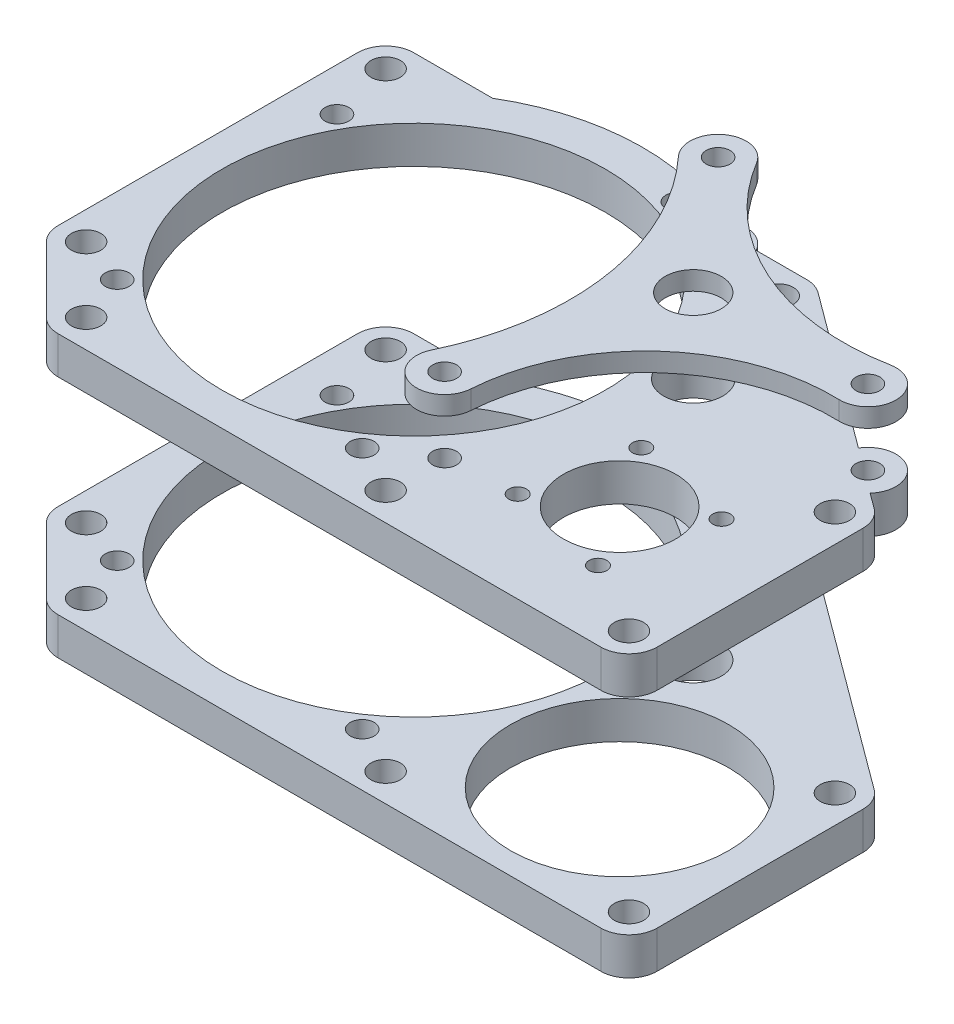
from build123d import *

# Parameters (mm, degrees)
SKETCH3_R               = 32.5
SKETCH3_R_2             = 2.4892
SKETCH3_R_3             = 18.5166
SKETCH3_R_4             = 4.7625
BOSS_EXTRUDE1_DEPTH     = 6.35
SKETCH4_R               = 2.4892
SKETCH4_R_2             = 5.0165
SKETCH4_R_3             = 9.525
SKETCH4_R_4             = 32.5
SKETCH4_R_5             = 2.0193
BOSS_EXTRUDE2_DEPTH     = 6.35
SKETCH6_R               = 4.7625
SKETCH6_R_2             = 2.0193
BOSS_EXTRUDE3_DEPTH     = 3.175
SKETCH8_R               = 1.5
CUT_EXTRUDE1_DEPTH      = 97.666893408
CUT_EXTRUDE2_DEPTH      = 97.666893408
CUT_EXTRUDE2_DEPTH_BACK = 97.666893408
SKETCH9_R               = 2.0193
BOSS_EXTRUDE4_DEPTH     = 6.35
BOSS_EXTRUDE5_DEPTH     = 6.35


with BuildPart() as part:
    # Sketch3 → Boss-Extrude1 (new body)
    with BuildSketch(Plane(origin=(0, 31.1, 0), x_dir=(1, 0, 0), z_dir=(0, 1, 0))):
        with BuildLine():
            Line((-38.1, 28.575), (-38.1, -22.225))
            ThreePointArc((-38.1, -22.225), (-37.737476274, -24.047529847), (-36.705096045, -25.592596045))
            Line((-36.705096045, -25.592596045), (-25.592596045, -36.705096045))
            ThreePointArc((-25.592596045, -36.705096045), (-24.047529847, -37.737476274), (-22.225, -38.1))
            Line((-22.225, -38.1), (69.85, -38.1))
            ThreePointArc((69.85, -38.1), (73.217596045, -36.705096045), (74.6125, -33.3375))
            Line((74.6125, -33.3375), (74.6125, 1.5875))
            ThreePointArc((74.6125, 1.5875), (74.102236551, 3.732235546), (72.680787428, 5.417388874))
            Line((72.680787428, 5.417388874), (36.168287428, 32.404888874))
            ThreePointArc((36.168287428, 32.404888874), (34.827728252, 33.098342349), (33.3375, 33.3375))
            Line((33.3375, 33.3375), (19.948272952, 33.3375))
            ThreePointArc((19.948272952, 33.3375), (0, 38.85), (-19.948272952, 33.3375))
            Line((-19.948272952, 33.3375), (-33.3375, 33.3375))
            ThreePointArc((-33.3375, 33.3375), (-36.705096045, 31.942596045), (-38.1, 28.575))
        make_face()
        with Locations(Location((0, 0, 0), (0, 0, 270))):
            Circle(SKETCH3_R, mode=Mode.SUBTRACT)
        with Locations(Location((-33.3375, 28.575, 0), (0, 0, 270))):
            Circle(SKETCH3_R_2, mode=Mode.SUBTRACT)
        with Locations(Location((-33.3375, -22.225, 0), (0, 0, 270))):
            Circle(SKETCH3_R_2, mode=Mode.SUBTRACT)
        with Locations(Location((-22.225, -33.3375, 0), (0, 0, 270))):
            Circle(SKETCH3_R_2, mode=Mode.SUBTRACT)
        with Locations(Location((28.575, -33.3375, 0), (0, 0, 270))):
            Circle(SKETCH3_R_2, mode=Mode.SUBTRACT)
        with Locations(Location((50.8, -15.875, 0), (0, 0, 270))):
            Circle(SKETCH3_R_3, mode=Mode.SUBTRACT)
        with Locations(Location((38.300729341, 9.113233891, 0), (0, 0, 270))):
            Circle(SKETCH3_R_4, mode=Mode.SUBTRACT)
        with Locations(Location((69.85, -33.3375, 0), (0, 0, 270))):
            Circle(SKETCH3_R_2, mode=Mode.SUBTRACT)
        with Locations(Location((69.85, 1.5875, 0), (0, 0, 270))):
            Circle(SKETCH3_R_2, mode=Mode.SUBTRACT)
        with Locations(Location((33.3375, 28.575, 0), (0, 0, 270))):
            Circle(SKETCH3_R_2, mode=Mode.SUBTRACT)
    extrude(amount=-BOSS_EXTRUDE1_DEPTH)


with BuildPart() as body_2:
    # Sketch4 → Boss-Extrude2 (new body)
    with BuildSketch(Plane(origin=(0, 66.025, 0), x_dir=(1, 0, 0), z_dir=(0, 1, 0))):
        with BuildLine():
            Line((62.449667408, 12.979521063), (36.168287428, 32.404888874))
            ThreePointArc((36.168287428, 32.404888874), (34.827728252, 33.098342349), (33.3375, 33.3375))
            Line((33.3375, 33.3375), (24.73840367, 33.3375))
            ThreePointArc((24.73840367, 33.3375), (21.42154073, 35.770829295), (17.446327433, 34.712363202))
            ThreePointArc((17.446327433, 34.712363202), (-1.427408509, 38.823768557), (-19.948272952, 33.3375))
            Line((-19.948272952, 33.3375), (-33.3375, 33.3375))
            ThreePointArc((-33.3375, 33.3375), (-36.705096045, 31.942596045), (-38.1, 28.575))
            Line((-38.1, 28.575), (-38.1, -22.225))
            ThreePointArc((-38.1, -22.225), (-37.737476274, -24.047529847), (-36.705096045, -25.592596045))
            Line((-36.705096045, -25.592596045), (-25.592596045, -36.705096045))
            ThreePointArc((-25.592596045, -36.705096045), (-24.047529847, -37.737476274), (-22.225, -38.1))
            Line((-22.225, -38.1), (69.85, -38.1))
            ThreePointArc((69.85, -38.1), (73.217596045, -36.705096045), (74.6125, -33.3375))
            Line((74.6125, -33.3375), (74.6125, 1.5875))
            ThreePointArc((74.6125, 1.5875), (74.102236551, 3.732235546), (72.680787428, 5.417388874))
            Line((72.680787428, 5.417388874), (70.077016055, 7.341915541))
            ThreePointArc((70.077016055, 7.341915541), (69.354337654, 14.342653962), (62.449667408, 12.979521063))
        make_face()
        with Locations(Location((33.3375, 28.575, 0), (0, 0, 270))):
            Circle(SKETCH4_R, mode=Mode.SUBTRACT)
        with Locations(Location((69.85, 1.5875, 0), (0, 0, 270))):
            Circle(SKETCH4_R, mode=Mode.SUBTRACT)
        with Locations(Location((69.85, -33.3375, 0), (0, 0, 270))):
            Circle(SKETCH4_R, mode=Mode.SUBTRACT)
        with Locations(Location((28.575, -33.3375, 0), (0, 0, 270))):
            Circle(SKETCH4_R, mode=Mode.SUBTRACT)
        with Locations(Location((-22.225, -33.3375, 0), (0, 0, 270))):
            Circle(SKETCH4_R, mode=Mode.SUBTRACT)
        with Locations(Location((-33.3375, -22.225, 0), (0, 0, 270))):
            Circle(SKETCH4_R, mode=Mode.SUBTRACT)
        with Locations(Location((-33.3375, 28.575, 0), (0, 0, 270))):
            Circle(SKETCH4_R, mode=Mode.SUBTRACT)
        with Locations(Location((38.300729341, 9.113233891, 0), (0, 0, 270))):
            Circle(SKETCH4_R_2, mode=Mode.SUBTRACT)
        with Locations(Location((50.8, -15.875, 0), (0, 0, 270))):
            Circle(SKETCH4_R_3, mode=Mode.SUBTRACT)
        with Locations(Location((0, 0, 0), (0, 0, 270))):
            Circle(SKETCH4_R_4, mode=Mode.SUBTRACT)
        with Locations(Location((20.539155692, 31.090786251, 0), (0, 0, 270))):
            Circle(SKETCH4_R_5, mode=Mode.SUBTRACT)
        with Locations(Location((66.523550225, 10.512765088, 0), (0, 0, 270))):
            Circle(SKETCH4_R_5, mode=Mode.SUBTRACT)
        with Locations(Location((28.838908317, -23.596848801, 0), (0, 0, 270))):
            Circle(SKETCH4_R_5, mode=Mode.SUBTRACT)
    extrude(amount=BOSS_EXTRUDE2_DEPTH)

    # Sketch8 → Cut-Extrude1 (cut, through all)
    with BuildSketch(Plane(origin=(0, 72.375, 0), x_dir=(1, 0, 0), z_dir=(0, 1, 0))):
        with Locations(Location((43.992012062, -5.391617901, 0), (0, 0, 270))):
            Circle(SKETCH8_R)
        with Locations(Location((61.283382099, -9.067012062, 0), (0, 0, 270))):
            Circle(SKETCH8_R)
        with Locations(Location((57.607987938, -26.358382099, 0), (0, 0, 270))):
            Circle(SKETCH8_R)
        with Locations(Location((40.316617901, -22.682987938, 0), (0, 0, 270))):
            Circle(SKETCH8_R)
    extrude(amount=-CUT_EXTRUDE1_DEPTH, mode=Mode.SUBTRACT)


with BuildPart() as body_3:
    # Sketch6 → Boss-Extrude3 (new body)
    with BuildSketch(Plane(origin=(0, 81.9, 0), x_dir=(1, 0, 0), z_dir=(0, 1, 0))):
        with BuildLine():
            ThreePointArc((24.617653876, 33.549903737), (17.675966632, 34.896512813), (17.046080919, 27.853528943))
            ThreePointArc((17.046080919, 27.853528943), (28.390816273, 4.30877568), (24.542631677, -21.54175433))
            ThreePointArc((24.542631677, -21.54175433), (27.634265494, -28.204477466), (33.591267315, -23.907477519))
            ThreePointArc((33.591267315, -23.907477519), (43.967359373, -2.438921321), (66.360521149, 5.753056298))
            ThreePointArc((66.360521149, 5.753056298), (71.272225212, 10.87538351), (65.639703676, 15.19253234))
            ThreePointArc((65.639703676, 15.19253234), (42.251924296, 17.942717846), (24.617653876, 33.549903737))
        make_face()
        with Locations(Location((38.300729341, 9.113233891, 0), (0, 0, 270))):
            Circle(SKETCH6_R, mode=Mode.SUBTRACT)
        with Locations(Location((28.838908317, -23.596848801, 0), (0, 0, 270))):
            Circle(SKETCH6_R_2, mode=Mode.SUBTRACT)
        with Locations(Location((66.523550225, 10.512765088, 0), (0, 0, 270))):
            Circle(SKETCH6_R_2, mode=Mode.SUBTRACT)
        with Locations(Location((20.539155692, 31.090786251, 0), (0, 0, 270))):
            Circle(SKETCH6_R_2, mode=Mode.SUBTRACT)
    extrude(amount=BOSS_EXTRUDE3_DEPTH)


with BuildPart() as cut_extrude2_tool:
    # Sketch9 → Cut-Extrude2 (new, two sides: drawn at the far end of the back side and taken through both)
    with BuildSketch(Plane(origin=(0, 72.375, 0), x_dir=(1, 0, 0), z_dir=(0, 1, 0)).offset(-CUT_EXTRUDE2_DEPTH_BACK)):
        with Locations(Location((-25.145212114, -25.145212114, 0), (0, 0, 270))):
            Circle(SKETCH9_R)
        with Locations(Location((20.39677958, -29.129620101, 0), (0, 0, 270))):
            Circle(SKETCH9_R)
        with Locations(Location((-30.796469576, 17.78035, 0), (0, 0, 270))):
            Circle(SKETCH9_R)
        with Locations(Location((10.988860632, 33.820235459, 0), (0, 0, 270))):
            Circle(SKETCH9_R)
    extrude(amount=CUT_EXTRUDE2_DEPTH + CUT_EXTRUDE2_DEPTH_BACK)


with BuildPart() as part_1:
    add(part.part)

    # Cut-Extrude2: cut by cut_extrude2_tool
    add(cut_extrude2_tool.part, mode=Mode.SUBTRACT)

    # Sketch11 → Boss-Extrude5 (add)
    with BuildSketch(Plane(origin=(0, 31.1, 0), x_dir=(1, 0, 0), z_dir=(0, 1, 0))):
        with BuildLine():
            Line((22.684169634, 33.3375), (19.948272952, 33.3375))
            ThreePointArc((19.948272952, 33.3375), (14.422665998, 36.0736636), (8.533760787, 37.901153371))
            ThreePointArc((8.533760787, 37.901153371), (10.448437112, 38.5519739), (12.460554068, 38.349642118))
            ThreePointArc((12.460554068, 38.349642118), (17.750163187, 36.206244835), (22.684169634, 33.3375))
        make_face()
    extrude(amount=-BOSS_EXTRUDE5_DEPTH)


with BuildPart() as body_2_1:
    add(body_2.part)

    # Cut-Extrude2: cut by cut_extrude2_tool
    add(cut_extrude2_tool.part, mode=Mode.SUBTRACT)

    # Sketch10 → Boss-Extrude4 (add)
    with BuildSketch(Plane(origin=(0, 72.375, 0), x_dir=(1, 0, 0), z_dir=(0, 1, 0))):
        with BuildLine():
            ThreePointArc((8.533760787, 37.901153371), (10.448437112, 38.5519739), (12.460554068, 38.349642118))
            ThreePointArc((12.460554068, 38.349642118), (15.77308116, 37.110246145), (18.964261824, 35.585351364))
            ThreePointArc((18.964261824, 35.585351364), (18.164827461, 35.219220786), (17.446327433, 34.712363202))
            ThreePointArc((17.446327433, 34.712363202), (13.087526186, 36.579217574), (8.533760787, 37.901153371))
        make_face()
    extrude(amount=-BOSS_EXTRUDE4_DEPTH)


solid = Compound([body_3.part, part_1.part, body_2_1.part])
